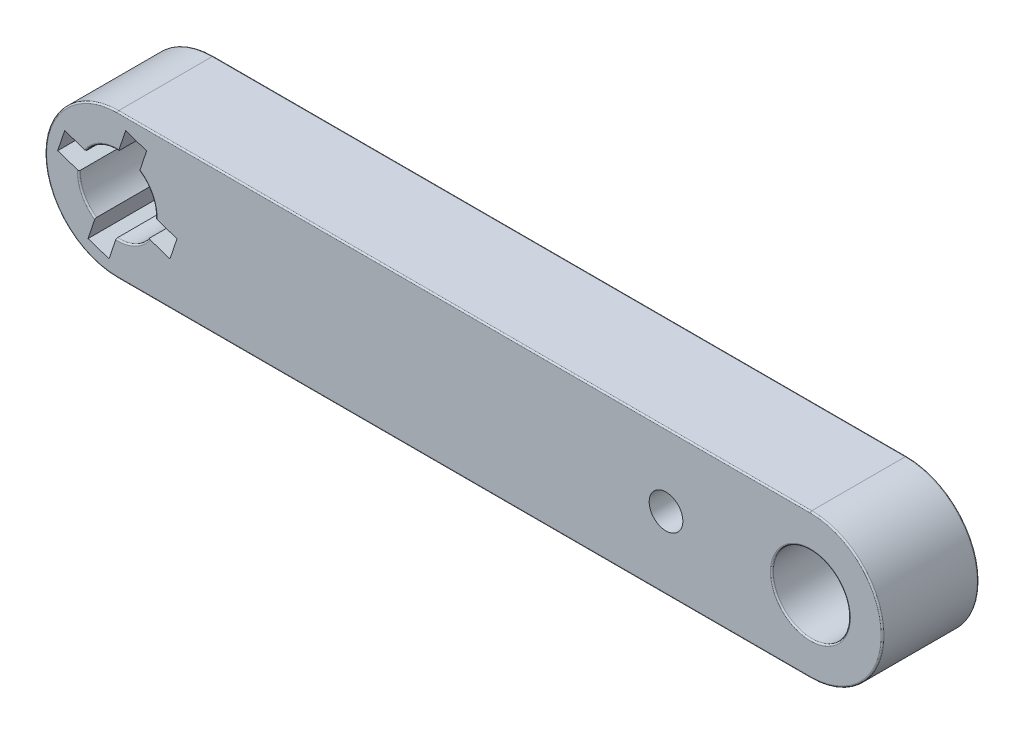
from build123d import *

# Parameters (mm, degrees)
SKETCH1_R           = 3.999999999999999
BOSS_EXTRUDE1_DEPTH = 5
FILLET2_R           = 0.15
CUT_EXTRUDE1_DEPTH  = 3
SKETCH3_R           = 1.7500000000000002
CUT_EXTRUDE2_DEPTH  = 45.693399960173195
CUT_EXTRUDE3_DEPTH  = 46.26035793053352


with BuildPart() as part:
    # Sketch1 → Boss-Extrude1 (new, symmetric)
    with BuildSketch(Plane.XY):
        with BuildLine():
            Line((-35.99999884518705, 7.5), (35.999998845200885, 7.5))
            ThreePointArc((35.999998845200885, 7.5), (43.50000000000009, -6.89855e-12), (35.999998845187086, -7.5))
            Line((35.999998845187086, -7.5), (-35.9999988452009, -7.5))
            ThreePointArc((-35.9999988452009, -7.5), (-43.500000000000085, 6.92631e-12), (-35.99999884518705, 7.5))
        make_face()
        with Locations((-36, 9.3e-16)):
            Circle(SKETCH1_R, mode=Mode.SUBTRACT)
        with Locations((36, 9.3e-16)):
            Circle(SKETCH1_R, mode=Mode.SUBTRACT)
    extrude(amount=BOSS_EXTRUDE1_DEPTH, both=True)

    # Fillet2
    fillet2_edges = [part.edges().sort_by_distance(p)[0] for p in [
        (-40, 1.42e-15, -5),
        (-40, 1.42e-15, 5),
        (-43.500000000000085, 6.92589e-12, 5),
        (32, 1.42e-15, -5),
        (32, 1.42e-15, 5),
        (-6.90648e-12, -7.5, 5),
        (43.50000000000009, -6.89891e-12, 5),
        (-6.90648e-12, -7.5, -5),
        (-43.500000000000085, 6.92589e-12, -5),
        (6.92069e-12, 7.5, -5),
        (43.50000000000009, -6.89891e-12, -5),
        (6.92069e-12, 7.5, 5),
    ]]
    fillet(fillet2_edges, radius=FILLET2_R)

    # Sketch2 → Cut-Extrude1 (cut)
    with BuildSketch(Plane(origin=(0, 0, -5), x_dir=(-1, 0, 0), z_dir=(0, 0, -1))):
        Polygon((-25.999999999999996, 4), (-15.999999999999996, 4), (-15.999999999999993, -3.9994), (-25.999999999999996, -3.9994), align=None)
    extrude(amount=-CUT_EXTRUDE1_DEPTH, mode=Mode.SUBTRACT)

    # Sketch3 → Cut-Extrude2 (cut, through all)
    with BuildSketch(Plane(origin=(0, 0, -2), x_dir=(-1, 0, 0), z_dir=(0, 0, -1))):
        with Locations((-20.999999999999996, 0.00030000000000169)):
            Circle(SKETCH3_R)
    extrude(amount=-CUT_EXTRUDE2_DEPTH, mode=Mode.SUBTRACT)

    # Sketch5 → Cut-Extrude3 (cut, through all)
    with BuildSketch(Plane.XY.offset(5)):
        with BuildLine():
            Line((-29.803056388089843, -0.8619105932905716), (-32.001976937220185, -0.12574414297812897))
            ThreePointArc((-32.001976937220185, -0.12574414297812897), (-32.419957559235066, 1.7841793974626035), (-33.693236215401576, 3.2678495745775873))
            Line((-33.693236215401576, 3.2678495745775873), (-32.95706976508913, 5.4667701237079385))
            Line((-32.95706976508913, 5.4667701237079385), (-35.13808940670864, 6.196943611907777))
            Line((-35.13808940670864, 6.196943611907777), (-35.87425585702112, 3.998023062777442))
            ThreePointArc((-35.87425585702112, 3.998023062777442), (-37.784179397461884, 3.580042440762558), (-39.267849574576886, 2.3067637845960194))
            Line((-39.267849574576886, 2.3067637845960194), (-41.46677012370723, 3.0429302349084826))
            Line((-41.46677012370723, 3.0429302349084826), (-42.19694361190705, 0.8619105932889741))
            Line((-42.19694361190705, 0.8619105932889741), (-39.99802306277672, 0.12574414297651035))
            ThreePointArc((-39.99802306277672, 0.12574414297651035), (-39.58004244076183, -1.784179397464253), (-38.30676378459529, -3.267849574579255))
            Line((-38.30676378459529, -3.267849574579255), (-39.042930234907736, -5.466770123709603))
            Line((-39.042930234907736, -5.466770123709603), (-36.86191059328822, -6.196943611909425))
            Line((-36.86191059328822, -6.196943611909425), (-36.12574414297573, -3.9980230627790863))
            ThreePointArc((-36.12574414297573, -3.9980230627790863), (-34.21582060253498, -3.580042440764184), (-32.73215042542, -2.3067637845976416))
            Line((-32.73215042542, -2.3067637845976416), (-30.53322987628966, -3.0429302349100853))
            Line((-30.53322987628966, -3.0429302349100853), (-29.803056388089843, -0.8619105932905716))
        make_face()
    extrude(amount=-CUT_EXTRUDE3_DEPTH, mode=Mode.SUBTRACT)


solid = part.part
